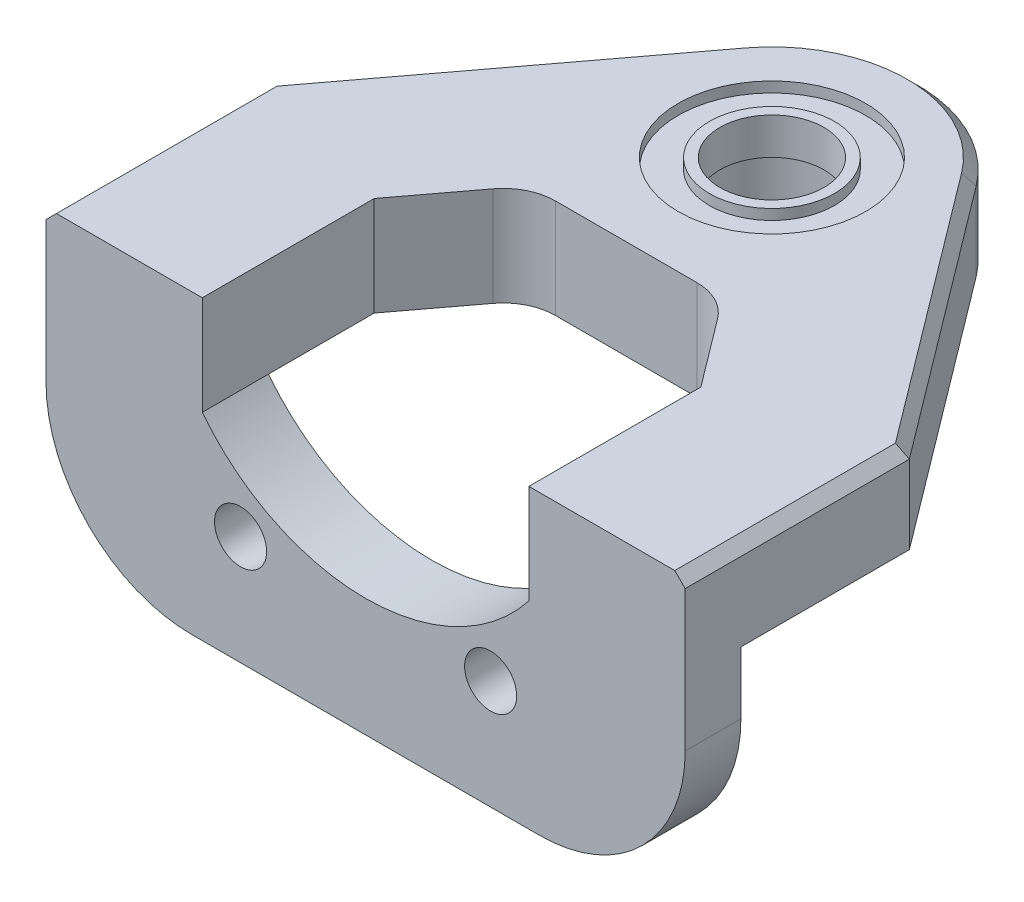
from build123d import *

# Parameters (mm, degrees)
SKETCH1_R           = 5
BOSS_EXTRUDE1_DEPTH = 4.7625
SKETCH2_R           = 9
SKETCH2_R_2         = 6
CUT_EXTRUDE1_DEPTH  = 1
FILLET1_R           = 5
CUT_EXTRUDE2_START  = -6
SKETCH3_R           = 6
CUT_EXTRUDE2_DEPTH  = 6
SKETCH4_R           = 2.5
BOSS_EXTRUDE2_DEPTH = 6.35
CHAMFER3_SIZE       = 1


with BuildPart() as part:
    # Sketch1 → Boss-Extrude1 (new, symmetric)
    with BuildSketch(Plane(origin=(0, 0, 0), x_dir=(1, 0, 0), z_dir=(0, 1, 0))):
        with BuildLine():
            Line((-30.675, 0), (-15.675, 0))
            Line((-15.675, 0), (-15.675, 10.154547549))
            Line((-15.675, 10.154547549), (-9.282686693, 18.65))
            Line((-9.282686693, 18.65), (9.282686693, 18.65))
            Line((9.282686693, 18.65), (15.675, 10.154547549))
            Line((15.675, 10.154547549), (15.675, 0))
            Line((15.675, 0), (30.675, 0))
            Line((30.675, 0), (30.675, 15.167545938))
            Line((30.675, 15.167545938), (11.186887419, 41.067455071))
            ThreePointArc((11.186887419, 41.067455071), (0, 46.65), (-11.186887419, 41.067455071))
            Line((-11.186887419, 41.067455071), (-30.675, 15.167545938))
            Line((-30.675, 15.167545938), (-30.675, 0))
        make_face()
        with Locations(Location((0, 32.65, 0), (0, 0, 90))):
            Circle(SKETCH1_R, mode=Mode.SUBTRACT)
    extrude(amount=BOSS_EXTRUDE1_DEPTH, both=True)

    # Sketch2 → Cut-Extrude1 (cut)
    with BuildSketch(Plane(origin=(0, 4.7625, 0), x_dir=(1, 0, 0), z_dir=(0, 1, 0))):
        with Locations(Location((0, 32.65, 0), (0, 0, 270))):
            Circle(SKETCH2_R)
        with Locations(Location((0, 32.65, 0), (0, 0, 270))):
            Circle(SKETCH2_R_2, mode=Mode.SUBTRACT)
    cut_extrude1 = extrude(amount=-CUT_EXTRUDE1_DEPTH, mode=Mode.SUBTRACT)

    # Fillet1
    fillet1_edges = [part.edges().sort_by_distance(p)[0] for p in [
        (9.282686693, 0, -18.65),
        (-9.282686693, 0, -18.65),
    ]]
    fillet(fillet1_edges, radius=FILLET1_R)

    # Sketch3 → Cut-Extrude2 (cut)
    with BuildSketch(Plane.XZ.offset(4.7625).offset(CUT_EXTRUDE2_START)):
        with Locations(Location((0, -32.65, 0), (0, 0, 90))):
            Circle(SKETCH3_R)
    extrude(amount=CUT_EXTRUDE2_DEPTH, mode=Mode.SUBTRACT)

    # Mirror2: Cut-Extrude1 across plane
    add(cut_extrude1.mirror(Plane.ZX), mode=Mode.SUBTRACT)

    # Sketch4 → Boss-Extrude2 (add)
    with BuildSketch(Plane.XY):
        with BuildLine():
            Line((-16.675, -23.7375), (16.675, -23.7375))
            ThreePointArc((16.675, -23.7375), (26.574494937, -19.636994937), (30.675, -9.7375))
            Line((30.675, -9.7375), (30.675, 4.7625))
            Line((30.675, 4.7625), (15.675, 4.7625))
            Line((15.675, 4.7625), (15.675, -4.7625))
            ThreePointArc((15.675, -4.7625), (0, -12.392034951), (-15.675, -4.7625))
            Line((-15.675, -4.7625), (-15.675, 4.7625))
            Line((-15.675, 4.7625), (-30.675, 4.7625))
            Line((-30.675, 4.7625), (-30.675, -9.7375))
            ThreePointArc((-30.675, -9.7375), (-26.574494937, -19.636994937), (-16.675, -23.7375))
        make_face()
        with Locations((-12, -13.259609691)):
            Circle(SKETCH4_R, mode=Mode.SUBTRACT)
        with Locations((12, -13.259609691)):
            Circle(SKETCH4_R, mode=Mode.SUBTRACT)
    extrude(amount=BOSS_EXTRUDE2_DEPTH)

    # Chamfer3
    chamfer3_edges = [part.edges().sort_by_distance(p)[0] for p in [
        (-20.93094371, -4.7625, -28.117500504),
        (0, -4.7625, -46.65),
        (20.93094371, -4.7625, -28.117500504),
        (30.675, -4.7625, -7.583772969),
        (-30.675, -4.7625, -7.583772969),
        (30.675, 4.7625, -4.408772969),
        (20.93094371, 4.7625, -28.117500504),
        (0, 4.7625, -46.65),
        (-20.93094371, 4.7625, -28.117500504),
        (-30.675, 4.7625, -4.408772969),
        (-30.675, -7.25, 0),
        (-26.574494937, -19.636994937, 0),
        (0, -23.7375, 0),
        (26.574494937, -19.636994937, 0),
        (30.675, -7.25, 0),
    ]]
    chamfer(chamfer3_edges, length=CHAMFER3_SIZE)


solid = part.part
